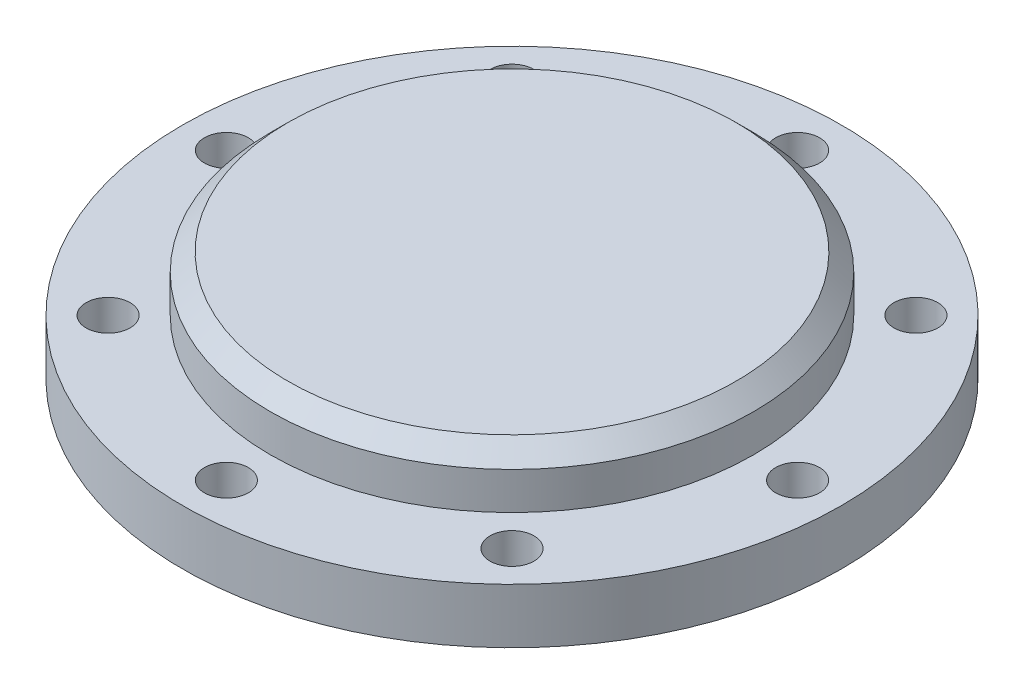
from build123d import *

# Parameters (mm, degrees)
SKETCH_4_R          = 2
CUT_EXTRUDE_1_DEPTH = 20


with BuildPart() as part:
    # Эскиз1 → Повернуть11 (revolve)
    with BuildSketch(Plane.XY):
        Polygon((-30, -10), (0, -10), (0, 0), (-20.4, 0), (-22, -1.6), (-22, -5), (-30, -5), align=None)
    revolve(axis=Axis((0, 0, 0), (0, -1, 0)))

    # Эскиз4 → Вырез-Вытянуть1 (cut)
    with BuildSketch(Plane(origin=(0, -5, 0), x_dir=(1, 0, 0), z_dir=(0, 1, 0))):
        with Locations(Location((0, 26, 0), (0, 0, 180))):
            Circle(SKETCH_4_R)
        with Locations(Location((18.384776311, 18.384776311, 0), (0, 0, 180))):
            Circle(SKETCH_4_R)
        with Locations(Location((26, 0, 0), (0, 0, 180))):
            Circle(SKETCH_4_R)
        with Locations(Location((18.384776311, -18.384776311, 0), (0, 0, 180))):
            Circle(SKETCH_4_R)
        with Locations(Location((0, -26, 0), (0, 0, 180))):
            Circle(SKETCH_4_R)
        with Locations(Location((-18.384776311, -18.384776311, 0), (0, 0, 180))):
            Circle(SKETCH_4_R)
        with Locations(Location((-26, 0, 0), (0, 0, 180))):
            Circle(SKETCH_4_R)
        with Locations(Location((-18.384776311, 18.384776311, 0), (0, 0, 180))):
            Circle(SKETCH_4_R)
    extrude(amount=-CUT_EXTRUDE_1_DEPTH, mode=Mode.SUBTRACT)


solid = part.part
